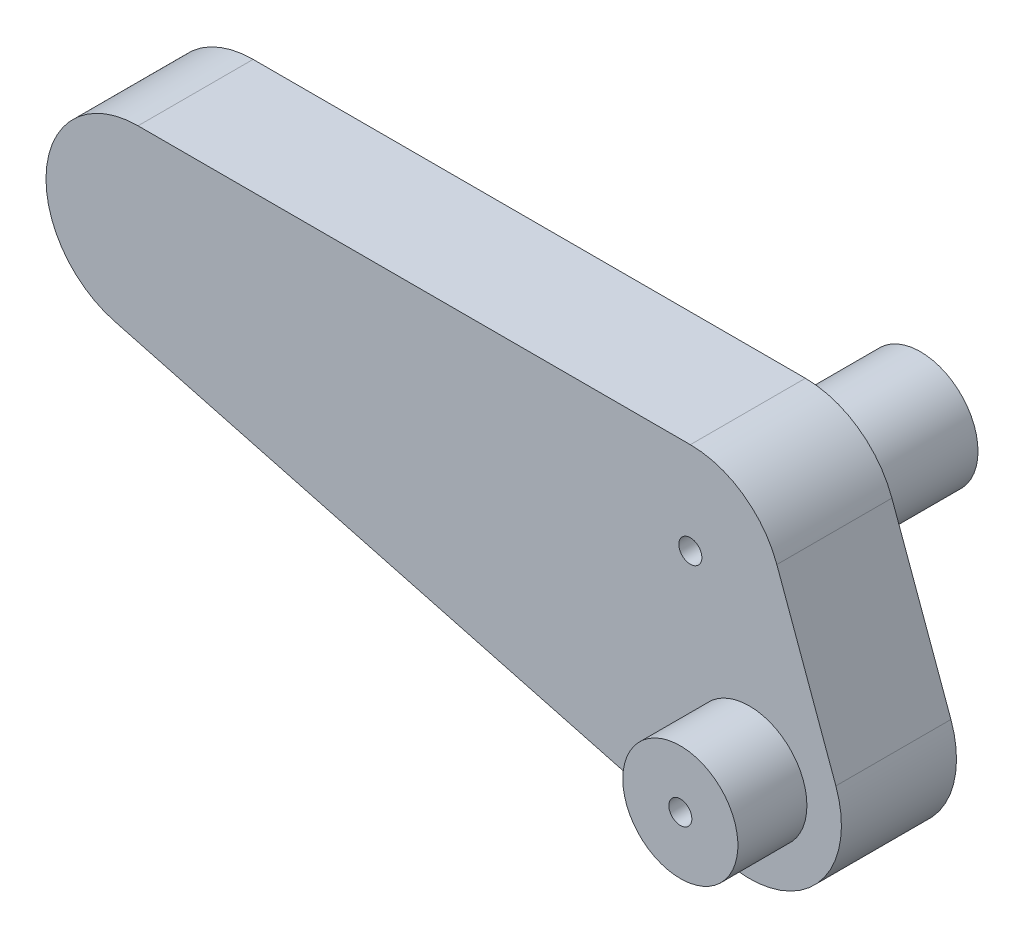
from build123d import *

# Parameters (mm, degrees)
SKETCH2_R           = 2.5
BOSS_EXTRUDE1_DEPTH = 5
BOSS_EXTRUDE2_START = -10
SKETCH3_R           = 2.5
SKETCH3_R_2         = 0.5
BOSS_EXTRUDE2_DEPTH = 10
SKETCH4_R           = 2.5
SKETCH4_R_2         = 0.5
BOSS_EXTRUDE3_DEPTH = 8
SKETCH5_R           = 2.5
BOSS_EXTRUDE4_DEPTH = 5


with BuildPart() as part:
    # Sketch2 → Boss-Extrude1 (new body)
    with BuildSketch(Plane.XY):
        with BuildLine():
            Line((-24, 4), (0, 4))
            ThreePointArc((0, 4), (2.294305745, 3.276608177), (3.758770483, 1.368080573))
            Line((3.758770483, 1.368080573), (6.323921558, -5.679614083))
            ThreePointArc((6.323921558, -5.679614083), (5.517602021, -9.746404239), (1.539439822, -10.913948195))
            Line((1.539439822, -10.913948195), (-25.025711253, -3.866253539))
            ThreePointArc((-25.025711253, -3.866253539), (-27.966422453, 0.51719718), (-24, 4))
        make_face()
        with Locations((-24, 0)):
            Circle(SKETCH2_R, mode=Mode.SUBTRACT)
        Circle(SKETCH2_R, mode=Mode.SUBTRACT)
        with Locations((2.565151075, -7.047694656)):
            Circle(SKETCH2_R, mode=Mode.SUBTRACT)
    extrude(amount=BOSS_EXTRUDE1_DEPTH)

    # Sketch3 → Boss-Extrude2 (add)
    with BuildSketch(Plane.XY.offset(5).offset(BOSS_EXTRUDE2_START)):
        Circle(SKETCH3_R)
        Circle(SKETCH3_R_2, mode=Mode.SUBTRACT)
    extrude(amount=BOSS_EXTRUDE2_DEPTH)

    # Sketch4 → Boss-Extrude3 (add)
    with BuildSketch(Plane(origin=(0, 0, 0), x_dir=(-1, 0, 0), z_dir=(0, 0, -1))):
        with Locations((-2.565151075, -7.047694656)):
            Circle(SKETCH4_R)
        with Locations((-2.565151075, -7.047694656)):
            Circle(SKETCH4_R_2, mode=Mode.SUBTRACT)
    extrude(amount=-BOSS_EXTRUDE3_DEPTH)

    # Sketch5 → Boss-Extrude4 (add)
    with BuildSketch(Plane(origin=(0, 0, 0), x_dir=(-1, 0, 0), z_dir=(0, 0, -1))):
        with Locations((24, 0)):
            Circle(SKETCH5_R)
    extrude(amount=-BOSS_EXTRUDE4_DEPTH)


solid = part.part
